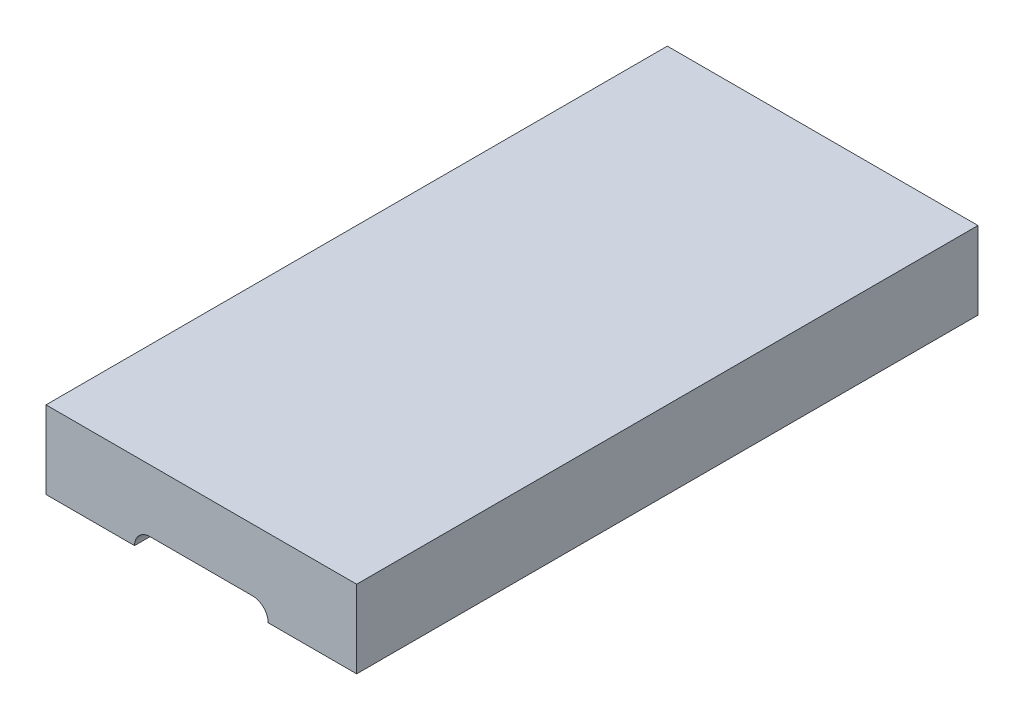
from build123d import *

# Parameters (mm, degrees)
SKETCH1_W           = 25.4
SKETCH1_H           = 12.7
BOSS_EXTRUDE1_DEPTH = 50.8
CUT_EXTRUDE1_DEPTH  = 50.8
SKETCH3_W           = 50.8
SKETCH3_H           = 6.35
CUT_EXTRUDE3_DEPTH  = 59.198711326
SKETCH5_W           = 20.32
SKETCH5_H           = 45.72
CUT_EXTRUDE4_DEPTH  = 3.81


with BuildPart() as part:
    # Sketch1 → Boss-Extrude1 (new body)
    with BuildSketch(Plane.XY):
        with Locations((12.7, 6.35)):
            Rectangle(SKETCH1_W, SKETCH1_H)
    extrude(amount=-BOSS_EXTRUDE1_DEPTH)

    # Sketch2 → Cut-Extrude1 (cut)
    with BuildSketch(Plane.XY):
        with BuildLine():
            Line((8.509, 7.62), (16.891, 7.62))
            ThreePointArc((16.891, 7.62), (18.161, 6.35), (16.891, 5.08))
            Line((16.891, 5.08), (8.509, 5.08))
            ThreePointArc((8.509, 5.08), (7.239, 6.35), (8.509, 7.62))
        make_face()
    extrude(amount=-CUT_EXTRUDE1_DEPTH, mode=Mode.SUBTRACT)

    # Sketch3 → Cut-Extrude3 (cut, through all)
    with BuildSketch(Plane(origin=(25.4, 0, 0), x_dir=(0, 0, -1), z_dir=(1, 0, 0))):
        with Locations((25.4, 3.175)):
            Rectangle(SKETCH3_W, SKETCH3_H)
    extrude(amount=-CUT_EXTRUDE3_DEPTH, mode=Mode.SUBTRACT)

    # Sketch5 → Cut-Extrude4 (cut)
    with BuildSketch(Plane.XZ.offset(-7.62)):
        with Locations((12.7, -25.4)):
            Rectangle(SKETCH5_W, SKETCH5_H)
    extrude(amount=-CUT_EXTRUDE4_DEPTH, mode=Mode.SUBTRACT)


solid = part.part
